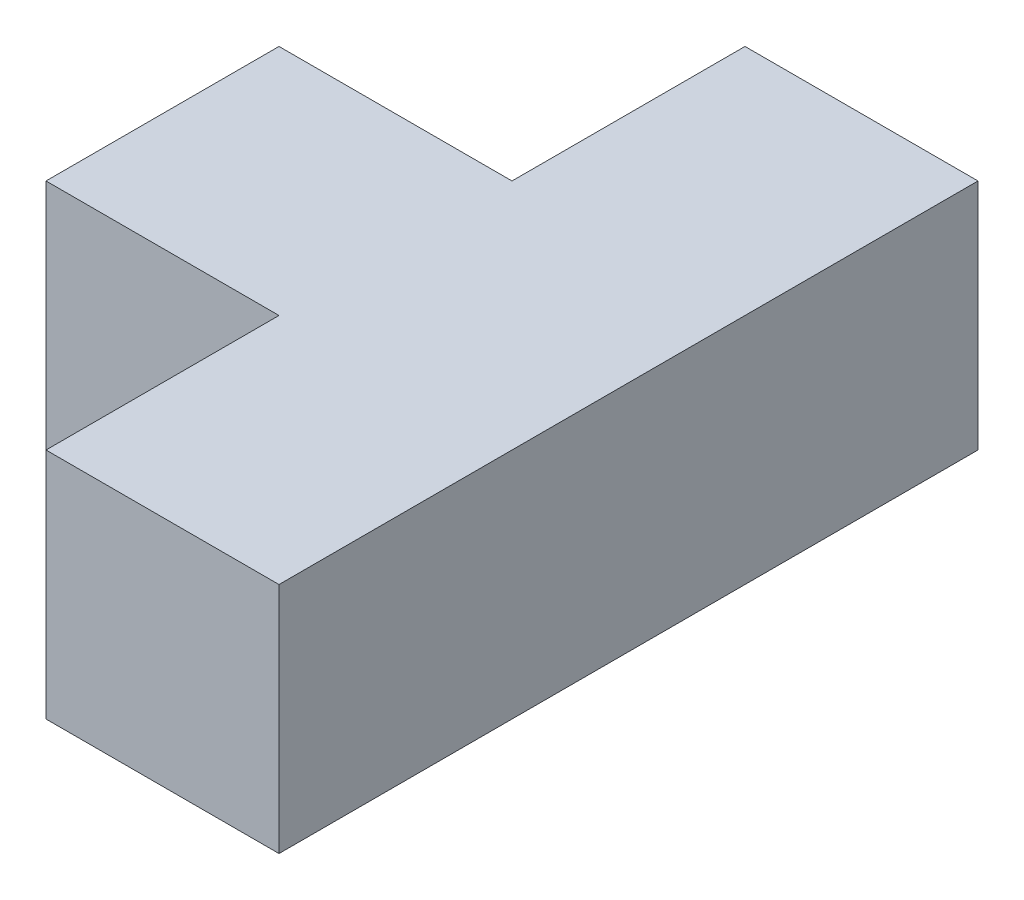
from build123d import *

# Parameters (mm, degrees)
BOSS_EXTRUDE1_DEPTH = 30


with BuildPart() as part:
    # Sketch1 → Boss-Extrude1 (new body)
    with BuildSketch(Plane(origin=(0, 0, 0), x_dir=(1, 0, 0), z_dir=(0, 1, 0))):
        Polygon((0, 0), (0, 30), (30, 30), (30, -60), (0, -60), (0, -30), (-30, -30), (-30, 0), align=None)
    extrude(amount=BOSS_EXTRUDE1_DEPTH)


solid = part.part
